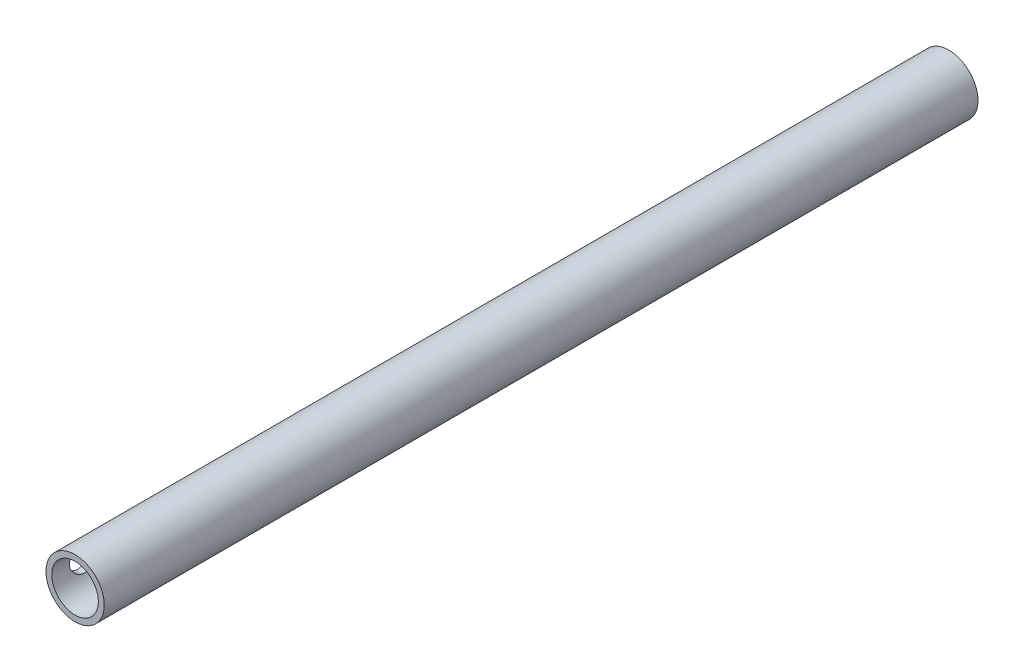
from build123d import *

# Parameters (mm, degrees)
SKETCH1_R           = 50
SKETCH1_R_2         = 40
BOSS_EXTRUDE1_DEPTH = 1500
SKETCH2_R           = 20
CUT_EXTRUDE1_DEPTH  = 100


with BuildPart() as part:
    # Sketch1 → Boss-Extrude1 (new body)
    with BuildSketch(Plane.XY):
        Circle(SKETCH1_R)
        Circle(SKETCH1_R_2, mode=Mode.SUBTRACT)
    extrude(amount=BOSS_EXTRUDE1_DEPTH)

    # Sketch2 → Cut-Extrude1 (cut)
    with BuildSketch(Plane(origin=(0, 0, 0), x_dir=(0, 0, -1), z_dir=(1, 0, 0))):
        with Locations(Location((-1450, 0, 0), (0, 0, 180))):
            Circle(SKETCH2_R)
        with Locations(Location((-1350, 0, 0), (0, 0, 180))):
            Circle(SKETCH2_R)
        with Locations(Location((-1250, 0, 0), (0, 0, 180))):
            Circle(SKETCH2_R)
        with Locations(Location((-1150, 0, 0), (0, 0, 180))):
            Circle(SKETCH2_R)
        with Locations(Location((-1050, 0, 0), (0, 0, 180))):
            Circle(SKETCH2_R)
        with Locations(Location((-950, 0, 0), (0, 0, 180))):
            Circle(SKETCH2_R)
        with Locations(Location((-850, 0, 0), (0, 0, 180))):
            Circle(SKETCH2_R)
        with Locations(Location((-750, 0, 0), (0, 0, 180))):
            Circle(SKETCH2_R)
        with Locations(Location((-650, 0, 0), (0, 0, 180))):
            Circle(SKETCH2_R)
        with Locations(Location((-550, 0, 0), (0, 0, 180))):
            Circle(SKETCH2_R)
        with Locations(Location((-450, 0, 0), (0, 0, 180))):
            Circle(SKETCH2_R)
        with Locations(Location((-350, 0, 0), (0, 0, 180))):
            Circle(SKETCH2_R)
        with Locations(Location((-250, 0, 0), (0, 0, 180))):
            Circle(SKETCH2_R)
        with Locations(Location((-150, 0, 0), (0, 0, 180))):
            Circle(SKETCH2_R)
        with Locations(Location((-50, 0, 0), (0, 0, 180))):
            Circle(SKETCH2_R)
    extrude(amount=-CUT_EXTRUDE1_DEPTH, mode=Mode.SUBTRACT)


solid = part.part
